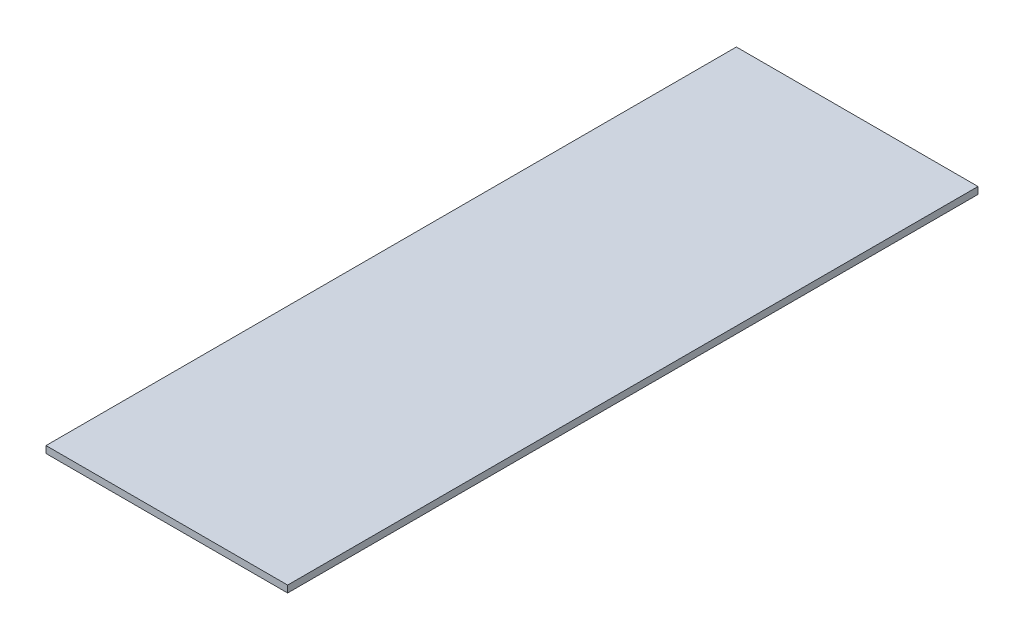
from build123d import *

# Parameters (mm, degrees)
CROQUIS1_W              = 70
CROQUIS1_H              = 200
SALIENTE_EXTRUIR1_DEPTH = 2


with BuildPart() as part:
    # Croquis1 → Saliente-Extruir1 (new body)
    with BuildSketch(Plane(origin=(0, 0, 0), x_dir=(1, 0, 0), z_dir=(0, 1, 0))):
        with Locations((-158.288590604, -8.053691275)):
            Rectangle(CROQUIS1_W, CROQUIS1_H)
    extrude(amount=SALIENTE_EXTRUIR1_DEPTH)


solid = part.part
